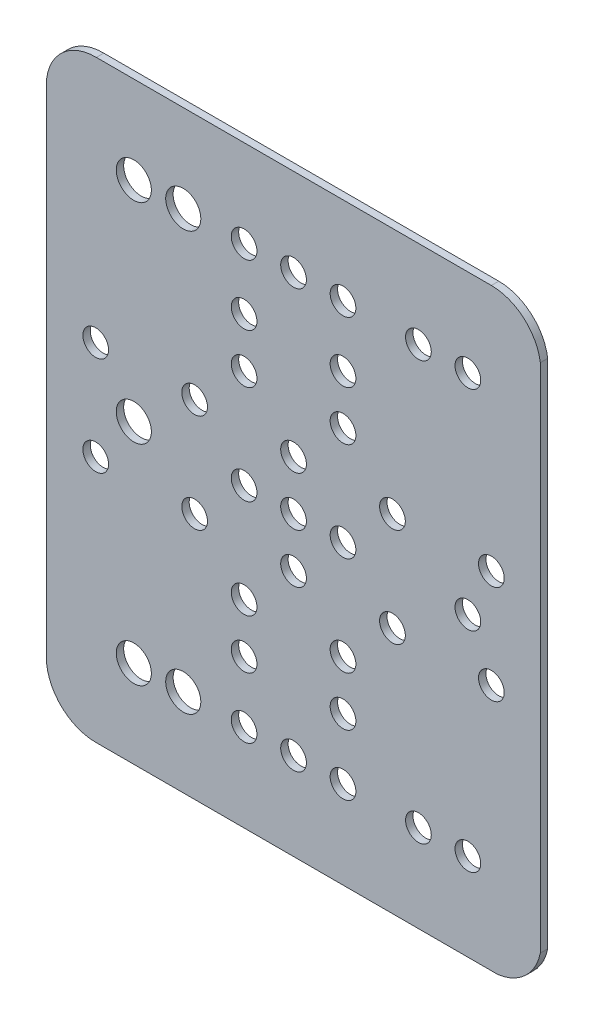
from build123d import *

# Parameters (mm, degrees)
SKETCH6_R           = 2.6
SKETCH6_R_2         = 3.55
BOSS_EXTRUDE2_DEPTH = 1.5


with BuildPart() as part:
    # Sketch6 → Boss-Extrude2 (new body)
    with BuildSketch(Plane.XY):
        with BuildLine():
            Line((90, 120), (10.125875384, 120))
            ThreePointArc((10.125875384, 120), (3.017939526, 117.160075149), (0, 110.125875384))
            Line((0, 110.125875384), (0, 10))
            ThreePointArc((0, 10), (2.928932188, 2.928932188), (10, 0))
            Line((10, 0), (91.314001846, 0))
            ThreePointArc((91.314001846, 0), (96.901124962, 2.644656697), (99.896074117, 8.052099098))
            Line((99.896074117, 8.052099098), (99.896074117, 111.437955866))
            ThreePointArc((99.896074117, 111.437955866), (96.542951984, 117.562392434), (90, 120))
        make_face()
        with Locations((50, 17.7)):
            Circle(SKETCH6_R, mode=Mode.SUBTRACT)
        with Locations((17.7, 17.7)):
            Circle(SKETCH6_R_2, mode=Mode.SUBTRACT)
        with Locations((75.25, 17.7)):
            Circle(SKETCH6_R, mode=Mode.SUBTRACT)
        with Locations((40, 17.7)):
            Circle(SKETCH6_R, mode=Mode.SUBTRACT)
        with Locations((60, 90)):
            Circle(SKETCH6_R, mode=Mode.SUBTRACT)
        with Locations((40, 90)):
            Circle(SKETCH6_R, mode=Mode.SUBTRACT)
        with Locations((60, 102.3)):
            Circle(SKETCH6_R, mode=Mode.SUBTRACT)
        with Locations((10, 50)):
            Circle(SKETCH6_R, mode=Mode.SUBTRACT)
        with Locations((70, 50)):
            Circle(SKETCH6_R, mode=Mode.SUBTRACT)
        with Locations((90, 70)):
            Circle(SKETCH6_R, mode=Mode.SUBTRACT)
        with Locations((30, 70)):
            Circle(SKETCH6_R, mode=Mode.SUBTRACT)
        with Locations((10, 70)):
            Circle(SKETCH6_R, mode=Mode.SUBTRACT)
        with Locations((17.7, 102.3)):
            Circle(SKETCH6_R_2, mode=Mode.SUBTRACT)
        with Locations((60, 30)):
            Circle(SKETCH6_R, mode=Mode.SUBTRACT)
        with Locations((85.25, 60)):
            Circle(SKETCH6_R, mode=Mode.SUBTRACT)
        with Locations((40, 60)):
            Circle(SKETCH6_R, mode=Mode.SUBTRACT)
        with Locations((60, 40)):
            Circle(SKETCH6_R, mode=Mode.SUBTRACT)
        with Locations((50, 102.3)):
            Circle(SKETCH6_R, mode=Mode.SUBTRACT)
        with Locations((50, 60)):
            Circle(SKETCH6_R, mode=Mode.SUBTRACT)
        with Locations((50, 70)):
            Circle(SKETCH6_R, mode=Mode.SUBTRACT)
        with Locations((50, 50)):
            Circle(SKETCH6_R, mode=Mode.SUBTRACT)
        with Locations((60, 60)):
            Circle(SKETCH6_R, mode=Mode.SUBTRACT)
        with Locations((17.7, 60)):
            Circle(SKETCH6_R_2, mode=Mode.SUBTRACT)
        with Locations((85.25, 102.3)):
            Circle(SKETCH6_R, mode=Mode.SUBTRACT)
        with Locations((40, 40)):
            Circle(SKETCH6_R, mode=Mode.SUBTRACT)
        with Locations((27.7, 102.3)):
            Circle(SKETCH6_R_2, mode=Mode.SUBTRACT)
        with Locations((40, 30)):
            Circle(SKETCH6_R, mode=Mode.SUBTRACT)
        with Locations((70, 70)):
            Circle(SKETCH6_R, mode=Mode.SUBTRACT)
        with Locations((90, 50)):
            Circle(SKETCH6_R, mode=Mode.SUBTRACT)
        with Locations((30, 50)):
            Circle(SKETCH6_R, mode=Mode.SUBTRACT)
        with Locations((75.25, 102.3)):
            Circle(SKETCH6_R, mode=Mode.SUBTRACT)
        with Locations((40, 102.3)):
            Circle(SKETCH6_R, mode=Mode.SUBTRACT)
        with Locations((40, 80)):
            Circle(SKETCH6_R, mode=Mode.SUBTRACT)
        with Locations((60, 80)):
            Circle(SKETCH6_R, mode=Mode.SUBTRACT)
        with Locations((60, 17.7)):
            Circle(SKETCH6_R, mode=Mode.SUBTRACT)
        with Locations((27.7, 17.7)):
            Circle(SKETCH6_R_2, mode=Mode.SUBTRACT)
        with Locations((85.25, 17.7)):
            Circle(SKETCH6_R, mode=Mode.SUBTRACT)
    extrude(amount=BOSS_EXTRUDE2_DEPTH)


solid = part.part
